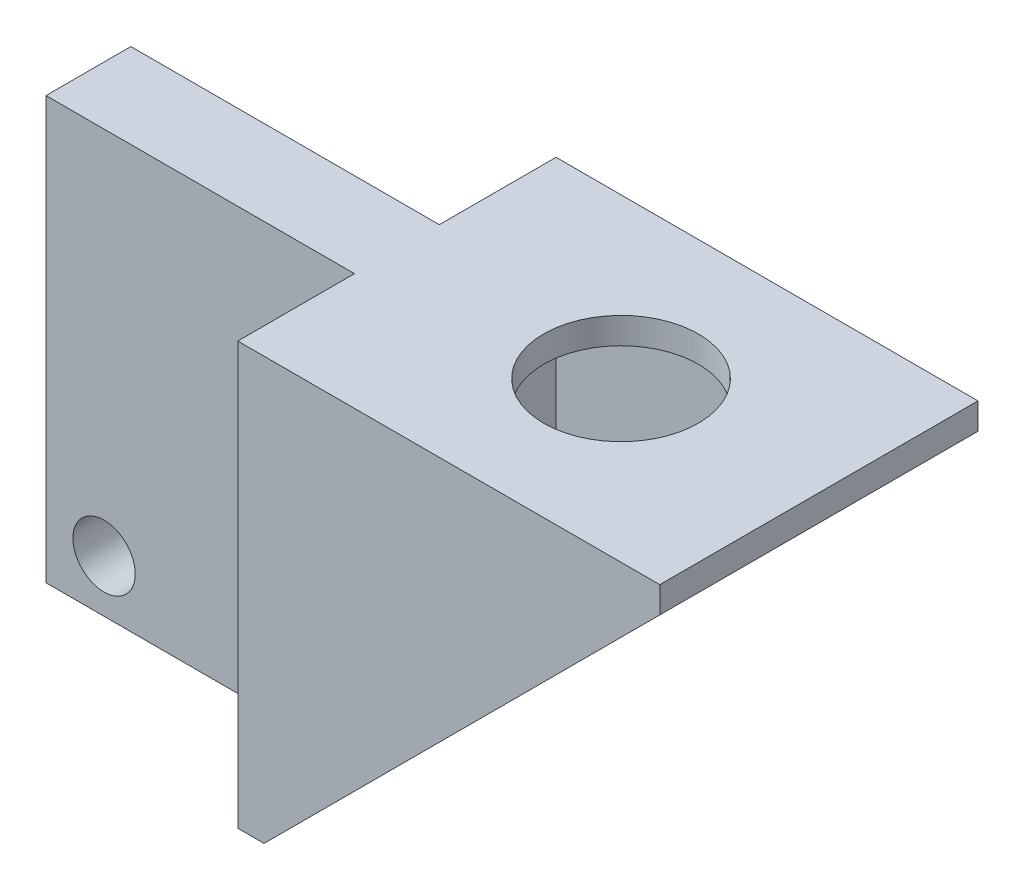
from build123d import *

# Parameters (mm, degrees)
SKETCH1_W           = 29.845
SKETCH1_H           = 24.003
SKETCH1_R           = 5.83565
BOSS_EXTRUDE1_DEPTH = 1.9812
SKETCH7_W           = 24.003
SKETCH7_H           = 31.8262
BOSS_EXTRUDE4_DEPTH = 1.9812
BOSS_EXTRUDE5_DEPTH = 1.9812
BOSS_EXTRUDE6_DEPTH = 1.9812
SKETCH10_W          = 6.4
SKETCH10_H          = 31.8262
BOSS_EXTRUDE7_DEPTH = 23.2664
SKETCH11_R          = 2.349999999
CUT_EXTRUDE1_DEPTH  = 65.474833866


with BuildPart() as part:
    # Sketch1 → Boss-Extrude1 (new body)
    with BuildSketch(Plane(origin=(0, 0, 0), x_dir=(1, 0, 0), z_dir=(0, 1, 0))):
        with Locations((-14.9225, 12.0015)):
            Rectangle(SKETCH1_W, SKETCH1_H)
        with Locations(Location((-14.9225, 12.0015, 0), (0, 0, 270))):
            Circle(SKETCH1_R, mode=Mode.SUBTRACT)
    extrude(amount=BOSS_EXTRUDE1_DEPTH)

    # Sketch7 → Boss-Extrude4 (add)
    with BuildSketch(Plane.ZY.offset(29.845)):
        with Locations((-12.0015, -13.9319)):
            Rectangle(SKETCH7_W, SKETCH7_H)
    extrude(amount=BOSS_EXTRUDE4_DEPTH)

    # Sketch8 → Boss-Extrude5 (add)
    with BuildSketch(Plane.XY):
        Polygon((-29.845, -29.845), (-29.845, 0), (0, 0), align=None)
    extrude(amount=-BOSS_EXTRUDE5_DEPTH)

    # Sketch9 → Boss-Extrude6 (add)
    with BuildSketch(Plane(origin=(0, 0, -24.003), x_dir=(-1, 0, 0), z_dir=(0, 0, -1))):
        Polygon((0, 0), (29.845, 0), (29.845, -29.845), align=None)
    extrude(amount=-BOSS_EXTRUDE6_DEPTH)

    # Sketch10 → Boss-Extrude7 (add)
    with BuildSketch(Plane.ZY.offset(31.8262)):
        with Locations((-12.0015, -13.9319)):
            Rectangle(SKETCH10_W, SKETCH10_H)
    extrude(amount=BOSS_EXTRUDE7_DEPTH)

    # Sketch11 → Cut-Extrude1 (cut, through all)
    with BuildSketch(Plane.XY.offset(-8.8015)):
        with Locations((-50.710600001, -25.908)):
            Circle(SKETCH11_R)
        with Locations((-36.260599945, -25.908)):
            Circle(SKETCH11_R)
    extrude(amount=-CUT_EXTRUDE1_DEPTH, mode=Mode.SUBTRACT)


solid = part.part
